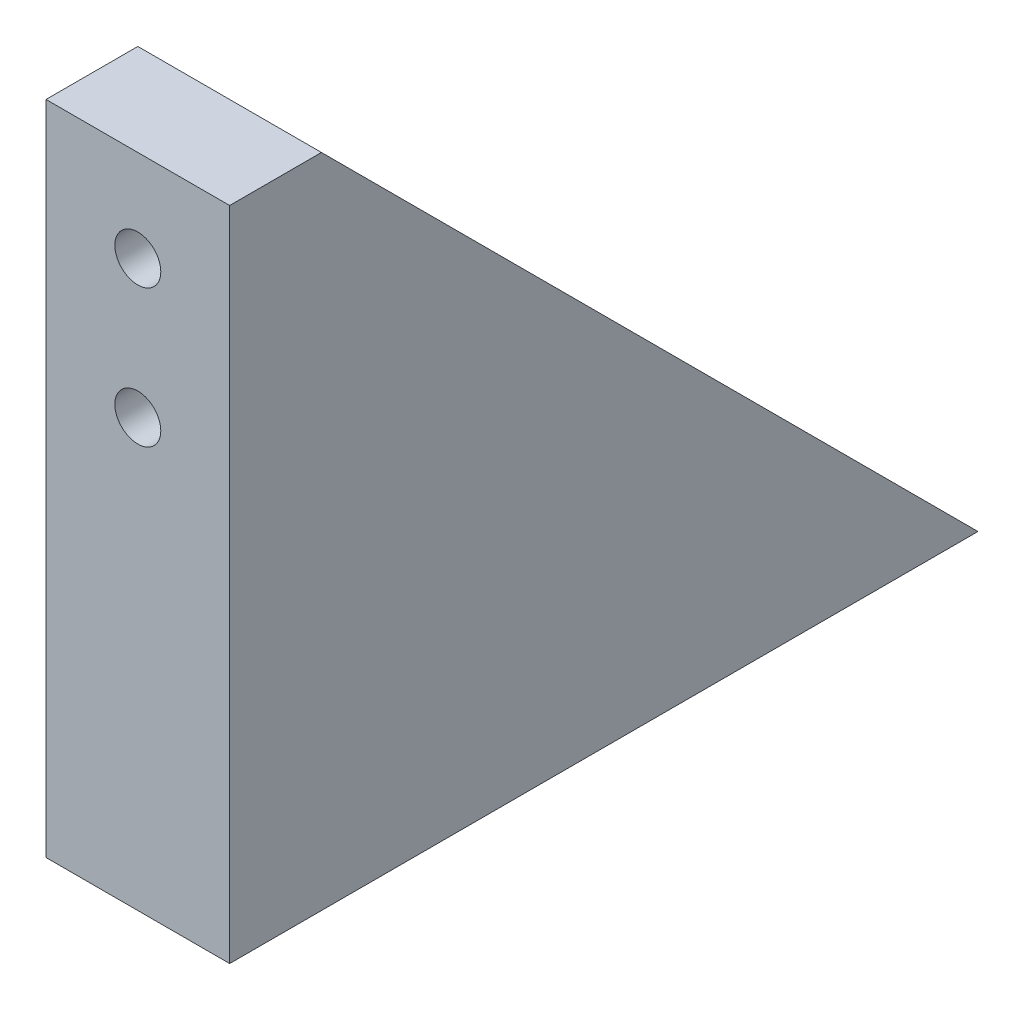
from build123d import *

# Parameters (mm, degrees)
SKETCH1_W           = 20
SKETCH1_H           = 71.5
SKETCH1_R           = 2.5
BOSS_EXTRUDE1_DEPTH = 5
BOSS_EXTRUDE2_DEPTH = 20
CUT_EXTRUDE1_REACH  = 82.562
SKETCH3_R           = 3.5
SKETCH4_R           = 1.5
CUT_EXTRUDE2_DEPTH  = 10


with BuildPart() as part:
    # Sketch1 → Boss-Extrude1 (new, symmetric)
    with BuildSketch(Plane.XY):
        Rectangle(SKETCH1_W, SKETCH1_H)
        with Locations((0, 25.75)):
            Circle(SKETCH1_R, mode=Mode.SUBTRACT)
        with Locations((0, 10.75)):
            Circle(SKETCH1_R, mode=Mode.SUBTRACT)
    extrude(amount=BOSS_EXTRUDE1_DEPTH, both=True)

    # Sketch2 → Boss-Extrude2 (add, through all)
    with BuildSketch(Plane(origin=(10, 0, 0), x_dir=(0, 0, -1), z_dir=(1, 0, 0))):
        Polygon((5, 35.75), (5, -35.75), (76.5, -35.75), align=None)
    extrude(amount=-BOSS_EXTRUDE2_DEPTH)

    # Cut-Extrude1: up to this plane
    cut_extrude1_end = Plane(origin=(-10, -35.75, -76.5), z_dir=(0, 0.7071067811865439, -0.7071067811865512))
    # Sketch3 → Cut-Extrude1 (cut, up to the surface)
    with BuildSketch(Plane.XY.offset(-5), mode=Mode.PRIVATE) as cut_extrude1_sk1:
        with Locations((0, 25.75)):
            Circle(SKETCH3_R)
    cut_extrude1_tool1 = split(extrude(cut_extrude1_sk1.sketch, amount=-CUT_EXTRUDE1_REACH, mode=Mode.PRIVATE), bisect_by=cut_extrude1_end, keep=Keep.BOTH, mode=Mode.PRIVATE)
    add(cut_extrude1_tool1.solids().sort_by_distance((0, 25.75, -5))[0], mode=Mode.SUBTRACT)
    # Sketch3 → Cut-Extrude1 (cut, up to the surface)
    with BuildSketch(Plane.XY.offset(-5), mode=Mode.PRIVATE) as cut_extrude1_sk2:
        with Locations((0, 10.75)):
            Circle(SKETCH3_R)
    cut_extrude1_tool2 = split(extrude(cut_extrude1_sk2.sketch, amount=-CUT_EXTRUDE1_REACH, mode=Mode.PRIVATE), bisect_by=cut_extrude1_end, keep=Keep.BOTH, mode=Mode.PRIVATE)
    add(cut_extrude1_tool2.solids().sort_by_distance((0, 10.75, -5))[0], mode=Mode.SUBTRACT)

    # Sketch4 → Cut-Extrude2 (cut)
    with BuildSketch(Plane.XZ.offset(35.75)):
        with Locations(Location((0, -5, 0), (0, 0, 270))):
            Circle(SKETCH4_R)
        with Locations(Location((0, -45, 0), (0, 0, 270))):
            Circle(SKETCH4_R)
    extrude(amount=-CUT_EXTRUDE2_DEPTH, mode=Mode.SUBTRACT)


solid = part.part
